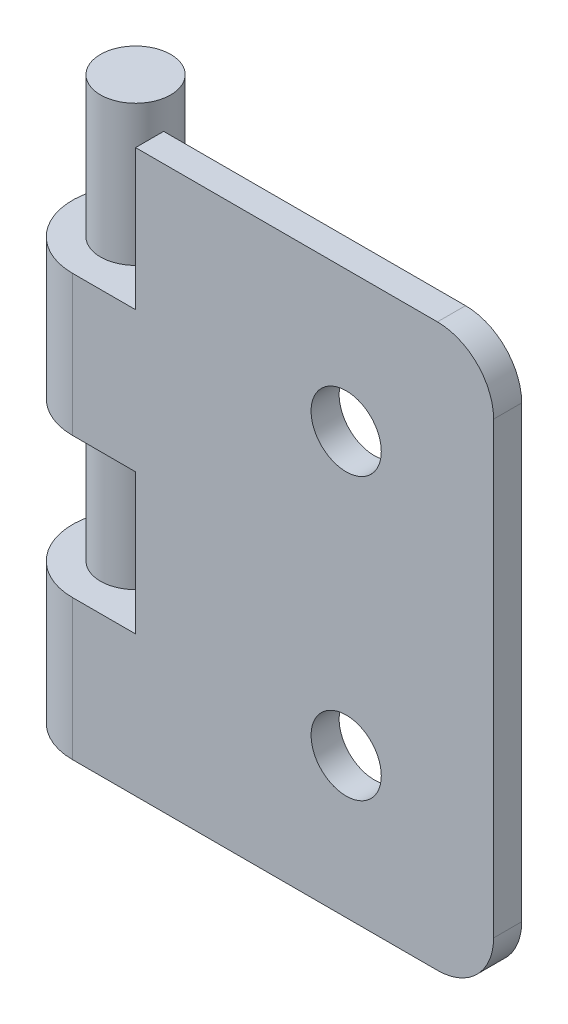
from build123d import *

# Parameters (mm, degrees)
SKETCH_1_R          = 2.5
EXTRUDE_1_DEPTH     = 40
CUT_EXTRUDE_1_REACH = 52.804
SKETCH_2_R          = 2.5
SKETCH_3_W          = 9
SKETCH_3_H          = 10
CUT_EXTRUDE_2_DEPTH = 20
FILLET_1_R          = 4
SKETCH_4_R          = 2.5
EXTRUDE_2_DEPTH     = 40


with BuildPart() as part:
    # 草图1 → 凸台-拉伸1 (new body)
    with BuildSketch(Plane(origin=(0, 0, 0), x_dir=(1, 0, 0), z_dir=(0, 1, 0))):
        with BuildLine():
            Line((0, -4.5), (30, -4.5))
            Line((30, -4.5), (30, -2.5))
            Line((30, -2.5), (3.741657387, -2.5))
            ThreePointArc((3.741657387, -2.5), (-2.121320344, 3.968626967), (0, -4.5))
        make_face()
        with Locations(Location((0, 0, 0), (0, 0, 270))):
            Circle(SKETCH_1_R, mode=Mode.SUBTRACT)
    extrude(amount=EXTRUDE_1_DEPTH)

    # 草图2 → 切除-拉伸1 (cut, up to next)
    with BuildSketch(Plane.XY.offset(4.5), mode=Mode.PRIVATE) as cut_extrude_1_sk1:
        with Locations((19.5, 30)):
            Circle(SKETCH_2_R)
    cut_extrude_1_tool1 = extrude(cut_extrude_1_sk1.sketch, amount=-CUT_EXTRUDE_1_REACH, mode=Mode.PRIVATE) & part.part
    # 草图2 → 切除-拉伸1 (cut, up to next)
    with BuildSketch(Plane.XY.offset(4.5), mode=Mode.PRIVATE) as cut_extrude_1_sk2:
        with Locations((19.5, 10)):
            Circle(SKETCH_2_R)
    cut_extrude_1_tool2 = extrude(cut_extrude_1_sk2.sketch, amount=-CUT_EXTRUDE_1_REACH, mode=Mode.PRIVATE) & part.part
    add(cut_extrude_1_tool1.solids().sort_by_distance((19.5, 30, 4.5))[0], mode=Mode.SUBTRACT)
    add(cut_extrude_1_tool2.solids().sort_by_distance((19.5, 10, 4.5))[0], mode=Mode.SUBTRACT)

    # 草图3 → 切除-拉伸2 (cut, symmetric)
    with BuildSketch(Plane(origin=(0, 0, 2.5), x_dir=(-1, 0, 0), z_dir=(0, 0, -1))):
        with Locations((0, 35)):
            Rectangle(SKETCH_3_W, SKETCH_3_H)
        with Locations((0, 15)):
            Rectangle(SKETCH_3_W, SKETCH_3_H)
    extrude(amount=CUT_EXTRUDE_2_DEPTH, both=True, mode=Mode.SUBTRACT)

    # 圆角1
    fillet_1_edges = [part.edges().sort_by_distance(p)[0] for p in [
        (30, 40, 3.5),
        (30, 0, 3.5),
    ]]
    fillet(fillet_1_edges, radius=FILLET_1_R)

    # 草图4 → 凸台-拉伸2 (add)
    with BuildSketch(Plane.XZ):
        with Locations(Location((0, 0, 0), (0, 0, 270))):
            Circle(SKETCH_4_R)
    extrude(amount=-EXTRUDE_2_DEPTH)


solid = part.part
